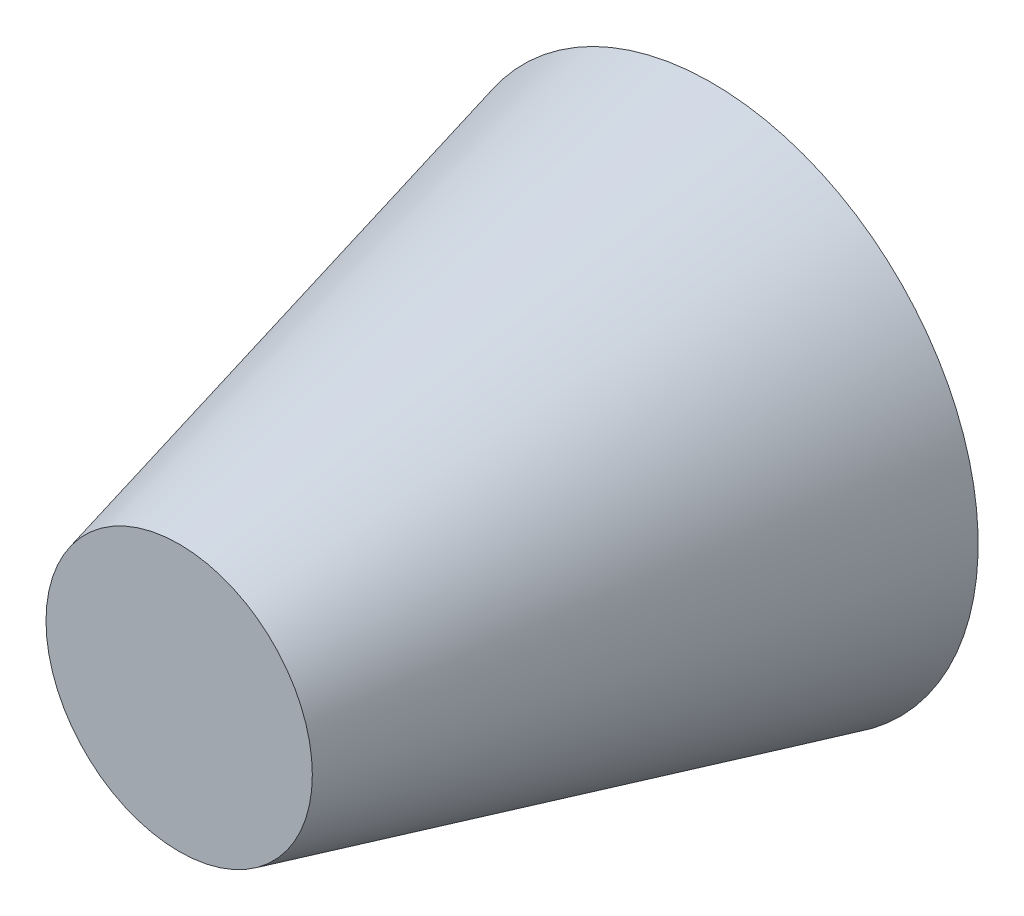
from build123d import *


with BuildPart() as part:
    # sketch:main-profile → feature:frustum (revolve)
    with BuildSketch(Plane.XZ, mode=Mode.PRIVATE) as feature_frustum_sk:
        Polygon((0, 0), (10, 0), (5, 20), (0, 20), align=None)
    revolve(feature_frustum_sk.sketch.rotate(Axis((0, 0, -5), (0, 0, 1)), 180), axis=Axis((0, 0, -5), (0, 0, 1)))


solid = part.part
